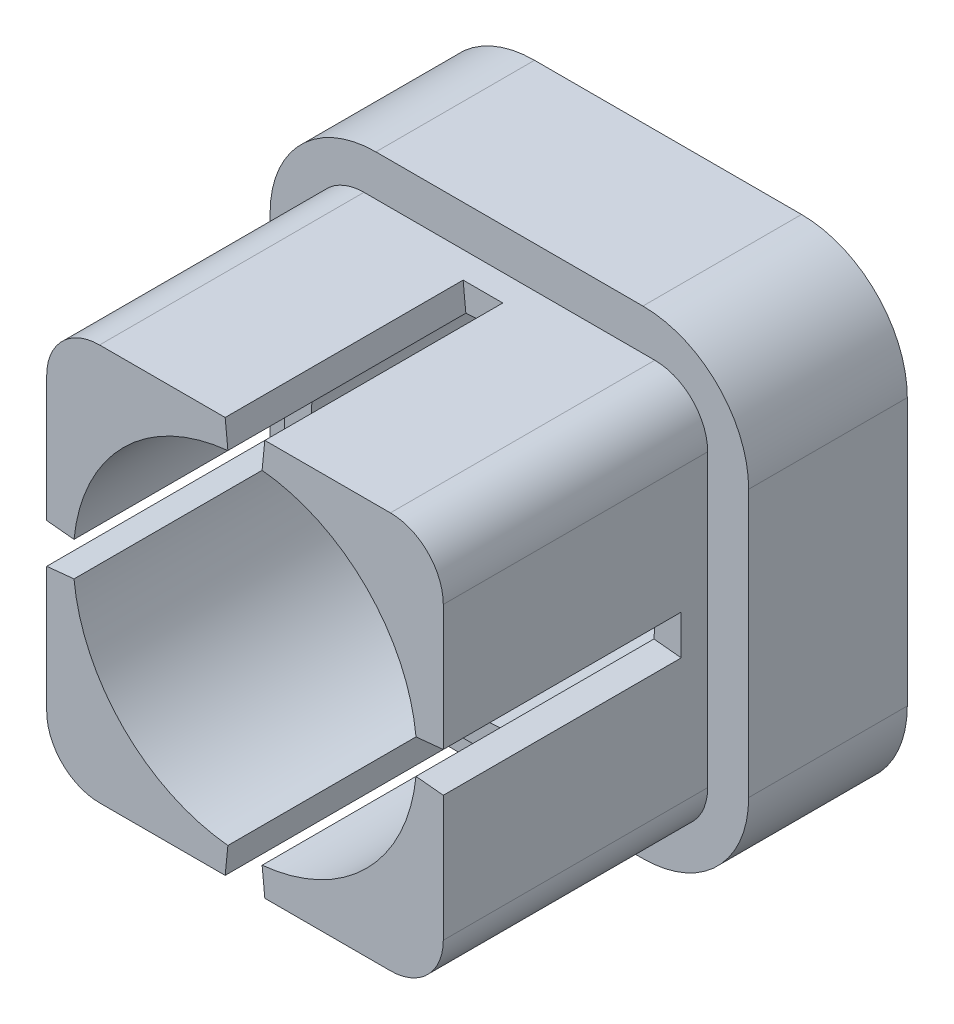
from build123d import *

# Parameters (mm, degrees)
BOSS_EXTRUDE1_DEPTH = 6
SKETCH3_R           = 6.5
BOSS_EXTRUDE2_DEPTH = 10
CUT_EXTRUDE1_DEPTH  = 9
CIRPATTERN1_COUNT   = 4
SKETCH5_R           = 6.5
CUT_EXTRUDE2_DEPTH  = 30


with BuildPart() as part:
    # Sketch1 → Boss-Extrude1 (new body)
    with BuildSketch(Plane.XY):
        with BuildLine():
            Line((-5.05, 9.05), (5.05, 9.05))
            ThreePointArc((5.05, 9.05), (7.878427125, 7.878427125), (9.05, 5.05))
            Line((9.05, 5.05), (9.05, -5.05))
            ThreePointArc((9.05, -5.05), (7.878427125, -7.878427125), (5.05, -9.05))
            Line((5.05, -9.05), (-5.05, -9.05))
            ThreePointArc((-5.05, -9.05), (-7.878427125, -7.878427125), (-9.05, -5.05))
            Line((-9.05, -5.05), (-9.05, 5.05))
            ThreePointArc((-9.05, 5.05), (-7.878427125, 7.878427125), (-5.05, 9.05))
        make_face()
    extrude(amount=BOSS_EXTRUDE1_DEPTH)

    # Sketch3 → Boss-Extrude2 (add)
    with BuildSketch(Plane.XY.offset(6)):
        with BuildLine():
            Line((-5.5, -7.5), (5.5, -7.5))
            ThreePointArc((5.5, -7.5), (6.914213562, -6.914213562), (7.5, -5.5))
            Line((7.5, -5.5), (7.5, 5.5))
            ThreePointArc((7.5, 5.5), (6.914213562, 6.914213562), (5.5, 7.5))
            Line((5.5, 7.5), (-5.5, 7.5))
            ThreePointArc((-5.5, 7.5), (-6.914213562, 6.914213562), (-7.5, 5.5))
            Line((-7.5, 5.5), (-7.5, -5.5))
            ThreePointArc((-7.5, -5.5), (-6.914213562, -6.914213562), (-5.5, -7.5))
        make_face()
        Circle(SKETCH3_R, mode=Mode.SUBTRACT)
    extrude(amount=BOSS_EXTRUDE2_DEPTH)

    # Sketch4 → Cut-Extrude1 (cut)
    with BuildSketch(Plane.XY.offset(16)):
        Polygon((0, 0), (7.5, 0.75), (7.5, -0.75), align=None)
    cut_extrude1 = extrude(amount=-CUT_EXTRUDE1_DEPTH, mode=Mode.SUBTRACT)

    # CirPattern1: Cut-Extrude1 ×4 about axis
    cirpattern1_axis = Axis((0, 0, 16), (0, 0, -1))
    for i in range(1, CIRPATTERN1_COUNT):
        add(cut_extrude1.rotate(cirpattern1_axis, i * 360 / CIRPATTERN1_COUNT), mode=Mode.SUBTRACT)

    # Sketch5 → Cut-Extrude2 (cut, symmetric)
    with BuildSketch(Plane.XY):
        with Locations(Location((0, 0, 0), (0, 0, 180))):
            Circle(SKETCH5_R)
    extrude(amount=CUT_EXTRUDE2_DEPTH, both=True, mode=Mode.SUBTRACT)


solid = part.part
